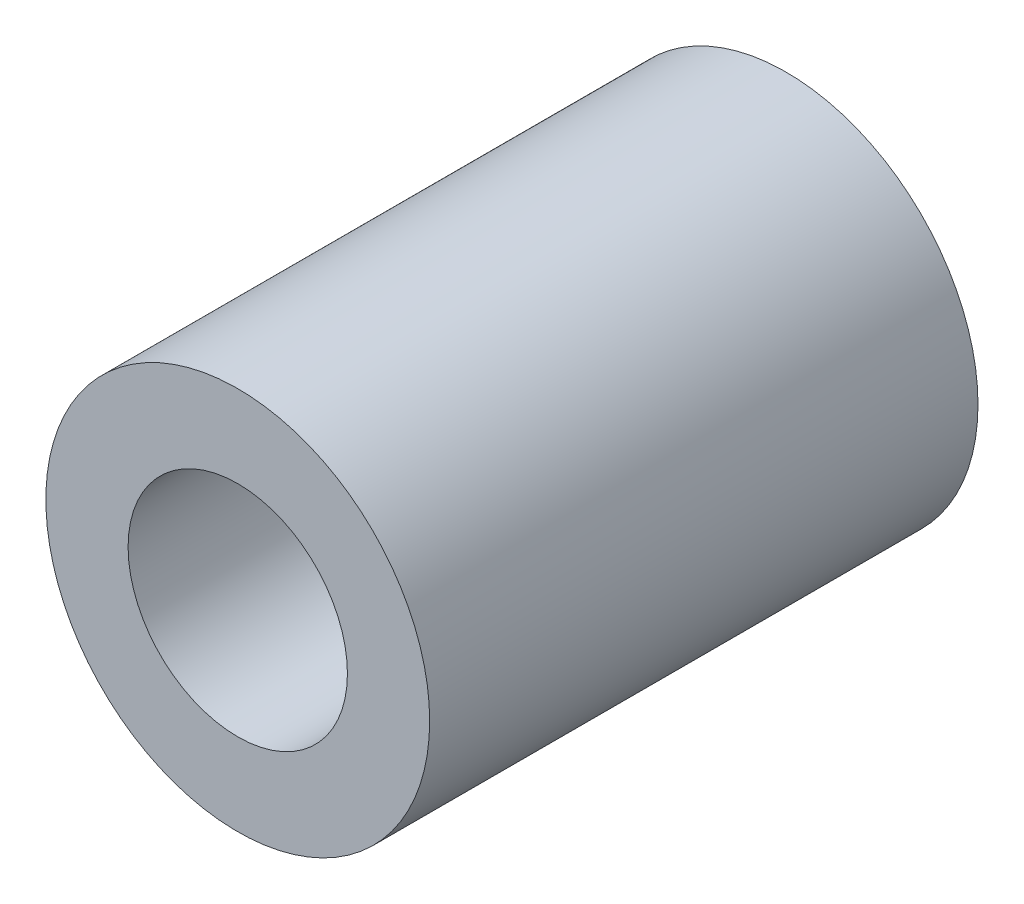
from build123d import *

# Parameters (mm, degrees)
SKETCH2_R           = 10.5
SKETCH2_R_2         = 6
BOSS_EXTRUDE1_DEPTH = 30


with BuildPart() as part:
    # Sketch2 → Boss-Extrude1 (new body)
    with BuildSketch(Plane.XY):
        Circle(SKETCH2_R)
        Circle(SKETCH2_R_2, mode=Mode.SUBTRACT)
    extrude(amount=BOSS_EXTRUDE1_DEPTH)


solid = part.part
